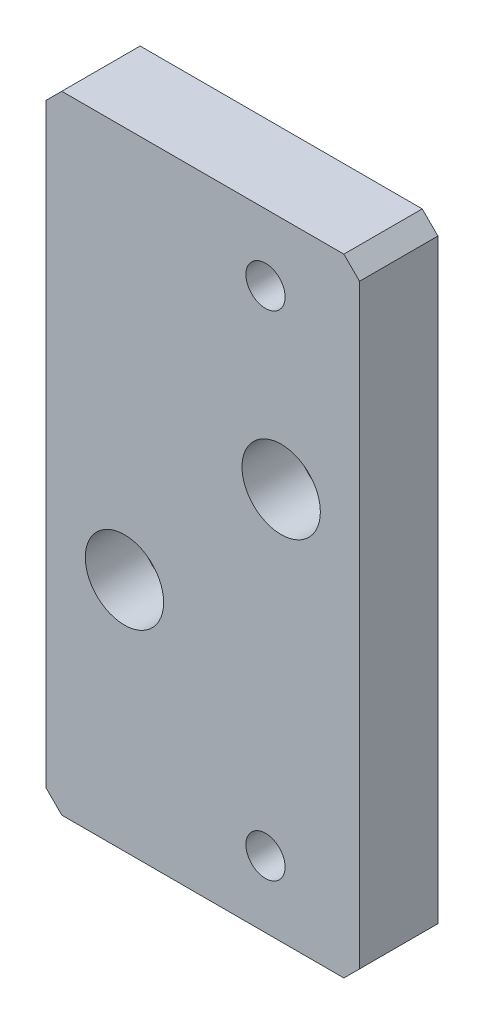
from build123d import *

# Parameters (mm, degrees)
ESQUISSE1_W                                        = 40
ESQUISSE1_H                                        = 80
BOSS_EXTRU_1_DEPTH                                 = 10
CHANFREIN1_SIZE                                    = 2
TROU_TARAUD_M61_D                                  = 5
CHAMBRAGE_POUR_VIS_T_TE_HEXAGONALE_M51_D           = 5.5
CHAMBRAGE_POUR_VIS_T_TE_HEXAGONALE_M51_CBORE_D     = 10
CHAMBRAGE_POUR_VIS_T_TE_HEXAGONALE_M51_CBORE_DEPTH = 7


with BuildPart() as part:
    # Esquisse1 → Boss.-Extru.1 (new body)
    with BuildSketch(Plane.XY):
        Rectangle(ESQUISSE1_W, ESQUISSE1_H)
    extrude(amount=BOSS_EXTRU_1_DEPTH)

    # Chanfrein1
    chanfrein1_edges = [part.edges().sort_by_distance(p)[0] for p in [
        (-20, 40, 5),
        (20, 40, 5),
        (20, -40, 5),
        (-20, -40, 5),
    ]]
    chamfer(chanfrein1_edges, length=CHANFREIN1_SIZE)

    # Trou taraudé M61 (through all)
    with Locations(Plane.XY.offset(10)):
        with Locations((8, 31.5), (8, -31.5)):
            Hole(TROU_TARAUD_M61_D / 2)

    # Chambrage pour vis à tête hexagonale M51 (through all)
    with Locations(Plane.XY.offset(10)):
        with Locations((10, 10), (-10, -10)):
            CounterBoreHole(CHAMBRAGE_POUR_VIS_T_TE_HEXAGONALE_M51_D / 2, CHAMBRAGE_POUR_VIS_T_TE_HEXAGONALE_M51_CBORE_D / 2, CHAMBRAGE_POUR_VIS_T_TE_HEXAGONALE_M51_CBORE_DEPTH)


solid = part.part
